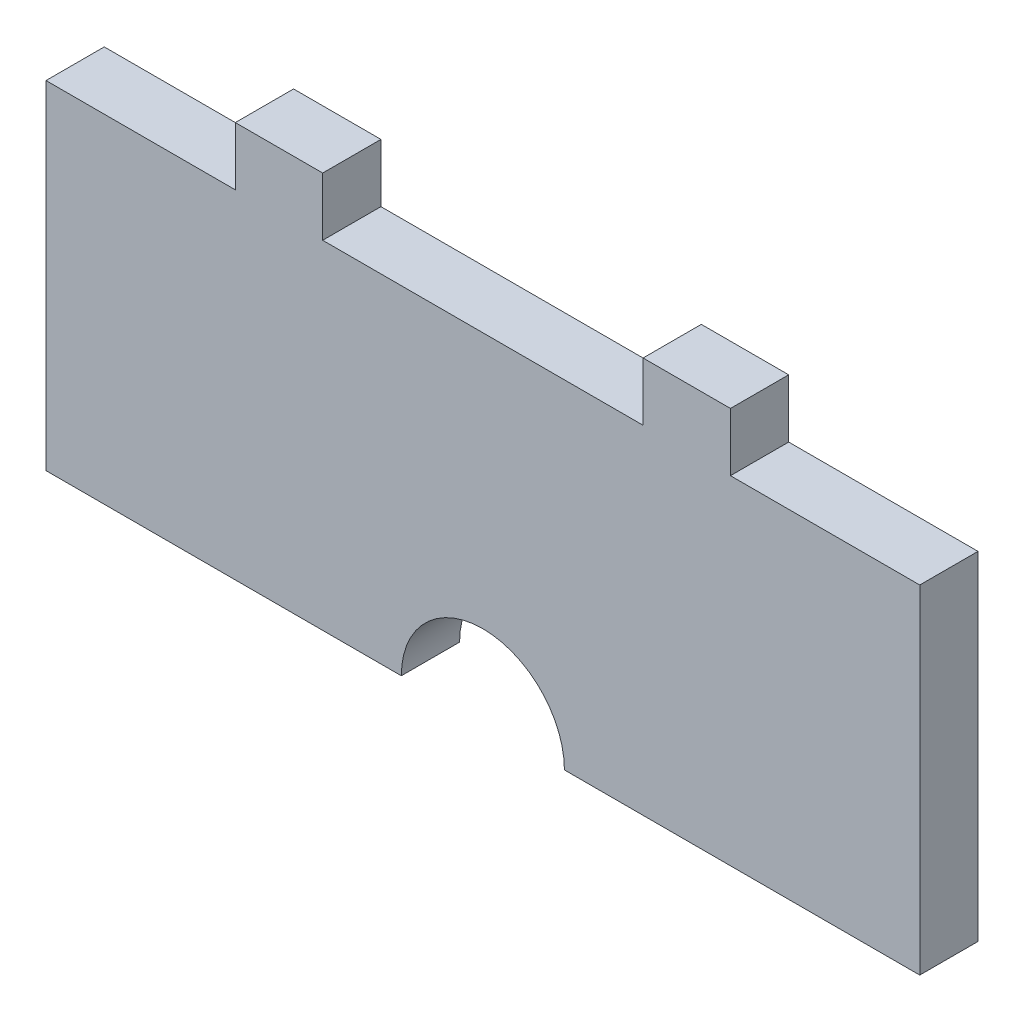
from build123d import *

# Parameters (mm, degrees)
EXTRUDE1_DEPTH     = 12.7
SKETCH2_R          = 17.78
CUT_EXTRUDE1_DEPTH = 256.897909331


with BuildPart() as part:
    # Sketch1 → Extrude1 (new body)
    with BuildSketch(Plane.XY):
        Polygon((-76.2, 215.9), (-34.925, 215.9), (-34.925, 228.6), (-15.875, 228.6), (-15.875, 215.9), (53.975, 215.9), (53.975, 228.6), (73.025, 228.6), (73.025, 215.9), (114.3, 215.9), (114.3, 142.24), (-76.2, 142.24), align=None)
    extrude(amount=-EXTRUDE1_DEPTH)

    # Sketch2 → Cut-Extrude1 (cut, through all)
    with BuildSketch(Plane.XY):
        with Locations((19.05, 142.24)):
            Circle(SKETCH2_R)
    extrude(amount=-CUT_EXTRUDE1_DEPTH, mode=Mode.SUBTRACT)


solid = part.part
